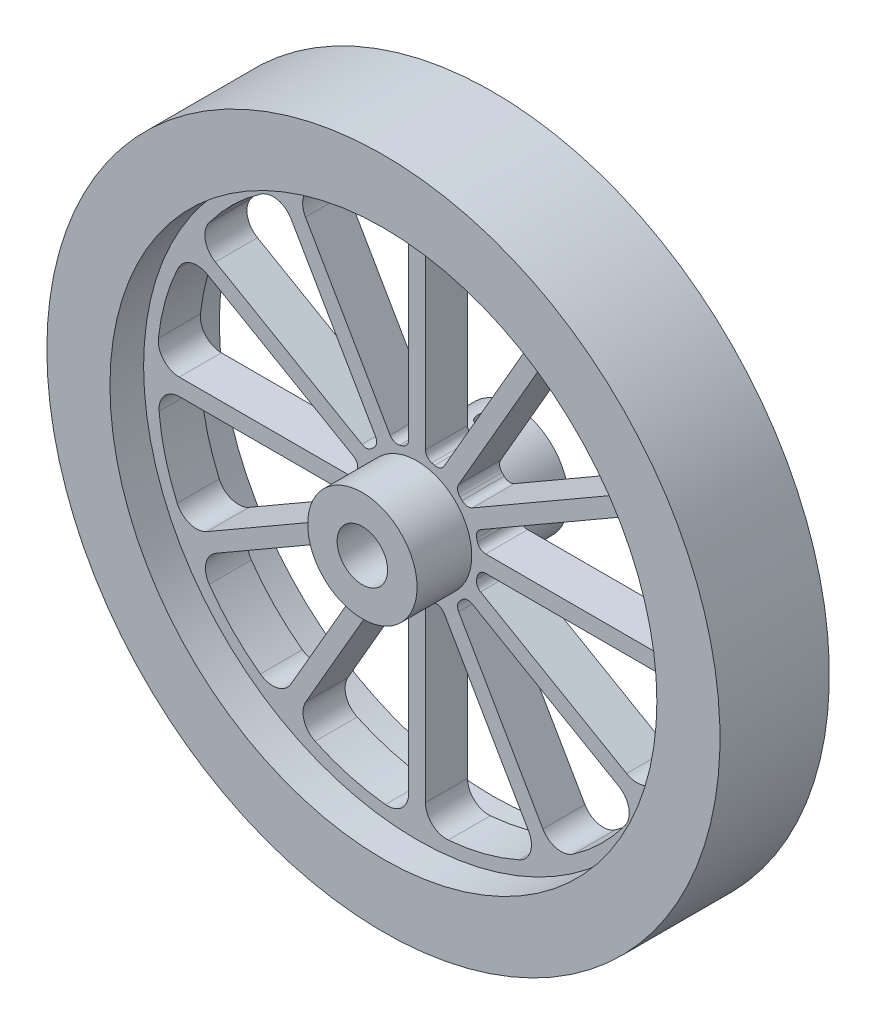
from build123d import *

# Parameters (mm, degrees)
SKETCH1_R           = 80
SKETCH1_R_2         = 65
BOSS_EXTRUDE1_DEPTH = 13
SKETCH1_4_R         = 65
SKETCH1_4_R_2       = 13
BOSS_EXTRUDE2_DEPTH = 5
SKETCH1_5_R         = 13
SKETCH1_5_R_2       = 6
BOSS_EXTRUDE3_DEPTH = 18
SKETCH3_R           = 2.5
CUT_EXTRUDE1_DEPTH  = 18


with BuildPart() as part:
    # Sketch1 → Boss-Extrude1 (new, symmetric)
    with BuildSketch(Plane.XY):
        Circle(SKETCH1_R)
        Circle(SKETCH1_R_2, mode=Mode.SUBTRACT)
    extrude(amount=BOSS_EXTRUDE1_DEPTH, both=True)

    # Sketch1<4> → Boss-Extrude2 (add, symmetric)
    with BuildSketch(Plane.XY):
        Circle(SKETCH1_4_R)
        with BuildLine():
            ThreePointArc((-10.194575037, -10.692798107), (-9.625898877, -11.845959285), (-9.876737792, -13.107011669))
            Line((-9.876737792, -13.107011669), (-29.989221362, -47.942855078))
            ThreePointArc((-29.989221362, -47.942855078), (-33.282212119, -50.334107308), (-37.262279736, -49.485027147))
            ThreePointArc((-37.262279736, -49.485027147), (-43.847720854, -43.796409306), (-49.400616804, -37.096129146))
            ThreePointArc((-49.400616804, -37.096129146), (-50.179569442, -33.149343226), (-47.799166853, -29.906262926))
            Line((-47.799166853, -29.906262926), (-13.107011669, -9.876737792))
            ThreePointArc((-13.107011669, -9.876737792), (-11.845959285, -9.625898877), (-10.692798107, -10.194575037))
            Line((-10.692798107, -10.194575037), (-10.194575037, -10.692798107))
        make_face(mode=Mode.SUBTRACT)
        with BuildLine():
            ThreePointArc((-3.48236191, -14.357522317), (-2.413293319, -15.071851111), (-2, -16.289373969))
            Line((-2, -16.289373969), (-2, -56.514341108))
            ThreePointArc((-2, -56.514341108), (-3.656187536, -60.231721665), (-7.527567281, -61.486430484))
            ThreePointArc((-7.527567281, -61.486430484), (-16.075035504, -59.85266348), (-24.234124542, -56.826498625))
            ThreePointArc((-24.234124542, -56.826498625), (-26.882110275, -53.797958073), (-26.442161311, -49.799166853))
            Line((-26.442161311, -49.799166853), (-6.412636177, -15.107011669))
            ThreePointArc((-6.412636177, -15.107011669), (-5.445952234, -14.259252604), (-4.162947279, -14.175160016))
            Line((-4.162947279, -14.175160016), (-3.48236191, -14.357522317))
        make_face(mode=Mode.SUBTRACT)
        with BuildLine():
            ThreePointArc((-14.175160016, -4.162947279), (-14.259252604, -5.445952234), (-15.107011669, -6.412636177))
            Line((-15.107011669, -6.412636177), (-49.942855078, -26.525119746))
            ThreePointArc((-49.942855078, -26.525119746), (-53.990294843, -26.949509546), (-57.012594428, -24.224150748))
            ThreePointArc((-57.012594428, -24.224150748), (-59.87144481, -16.004942627), (-61.330253688, -7.425881821))
            ThreePointArc((-61.330253688, -7.425881821), (-60.0314535, -3.618388631), (-56.348424237, -2))
            Line((-56.348424237, -2), (-16.289373969, -2))
            ThreePointArc((-16.289373969, -2), (-15.071851111, -2.413293319), (-14.357522317, -3.48236191))
            Line((-14.357522317, -3.48236191), (-14.175160016, -4.162947279))
        make_face(mode=Mode.SUBTRACT)
        Circle(SKETCH1_4_R_2, mode=Mode.SUBTRACT)
        with BuildLine():
            ThreePointArc((4.162947279, -14.175160016), (5.445952234, -14.259252604), (6.412636177, -15.107011669))
            Line((6.412636177, -15.107011669), (26.525119746, -49.942855078))
            ThreePointArc((26.525119746, -49.942855078), (26.949509546, -53.990294843), (24.224150748, -57.012594428))
            ThreePointArc((24.224150748, -57.012594428), (16.004942627, -59.87144481), (7.425881821, -61.330253688))
            ThreePointArc((7.425881821, -61.330253688), (3.618388631, -60.0314535), (2, -56.348424237))
            Line((2, -56.348424237), (2, -16.289373969))
            ThreePointArc((2, -16.289373969), (2.413293319, -15.071851111), (3.48236191, -14.357522317))
            Line((3.48236191, -14.357522317), (4.162947279, -14.175160016))
        make_face(mode=Mode.SUBTRACT)
        with BuildLine():
            ThreePointArc((10.692798107, -10.194575037), (11.845959285, -9.625898877), (13.107011669, -9.876737792))
            Line((13.107011669, -9.876737792), (47.942855078, -29.989221362))
            ThreePointArc((47.942855078, -29.989221362), (50.334107308, -33.282212119), (49.485027147, -37.262279736))
            ThreePointArc((49.485027147, -37.262279736), (43.796409306, -43.847720854), (37.096129146, -49.400616804))
            ThreePointArc((37.096129146, -49.400616804), (33.149343226, -50.179569442), (29.906262926, -47.799166853))
            Line((29.906262926, -47.799166853), (9.876737792, -13.107011669))
            ThreePointArc((9.876737792, -13.107011669), (9.625898877, -11.845959285), (10.194575037, -10.692798107))
            Line((10.194575037, -10.692798107), (10.692798107, -10.194575037))
        make_face(mode=Mode.SUBTRACT)
        with BuildLine():
            ThreePointArc((14.357522317, -3.48236191), (15.071851111, -2.413293319), (16.289373969, -2))
            Line((16.289373969, -2), (56.514341108, -2))
            ThreePointArc((56.514341108, -2), (60.231721665, -3.656187536), (61.486430484, -7.527567281))
            ThreePointArc((61.486430484, -7.527567281), (59.85266348, -16.075035504), (56.826498625, -24.234124542))
            ThreePointArc((56.826498625, -24.234124542), (53.797958073, -26.882110275), (49.799166853, -26.442161311))
            Line((49.799166853, -26.442161311), (15.107011669, -6.412636177))
            ThreePointArc((15.107011669, -6.412636177), (14.259252604, -5.445952234), (14.175160016, -4.162947279))
            Line((14.175160016, -4.162947279), (14.357522317, -3.48236191))
        make_face(mode=Mode.SUBTRACT)
        with BuildLine():
            ThreePointArc((-14.357522317, 3.48236191), (-15.071851111, 2.413293319), (-16.289373969, 2))
            Line((-16.289373969, 2), (-56.514341108, 2))
            ThreePointArc((-56.514341108, 2), (-60.231721665, 3.656187536), (-61.486430484, 7.527567281))
            ThreePointArc((-61.486430484, 7.527567281), (-59.85266348, 16.075035504), (-56.826498625, 24.234124542))
            ThreePointArc((-56.826498625, 24.234124542), (-53.797958073, 26.882110275), (-49.799166853, 26.442161311))
            Line((-49.799166853, 26.442161311), (-15.107011669, 6.412636177))
            ThreePointArc((-15.107011669, 6.412636177), (-14.259252604, 5.445952234), (-14.175160016, 4.162947279))
            Line((-14.175160016, 4.162947279), (-14.357522317, 3.48236191))
        make_face(mode=Mode.SUBTRACT)
        with BuildLine():
            ThreePointArc((-10.692798107, 10.194575037), (-11.845959285, 9.625898877), (-13.107011669, 9.876737792))
            Line((-13.107011669, 9.876737792), (-47.942855078, 29.989221362))
            ThreePointArc((-47.942855078, 29.989221362), (-50.334107308, 33.282212119), (-49.485027147, 37.262279736))
            ThreePointArc((-49.485027147, 37.262279736), (-43.796409306, 43.847720854), (-37.096129146, 49.400616804))
            ThreePointArc((-37.096129146, 49.400616804), (-33.149343226, 50.179569442), (-29.906262926, 47.799166853))
            Line((-29.906262926, 47.799166853), (-9.876737792, 13.107011669))
            ThreePointArc((-9.876737792, 13.107011669), (-9.625898877, 11.845959285), (-10.194575037, 10.692798107))
            Line((-10.194575037, 10.692798107), (-10.692798107, 10.194575037))
        make_face(mode=Mode.SUBTRACT)
        with BuildLine():
            ThreePointArc((-4.162947279, 14.175160016), (-5.445952234, 14.259252604), (-6.412636177, 15.107011669))
            Line((-6.412636177, 15.107011669), (-26.525119746, 49.942855078))
            ThreePointArc((-26.525119746, 49.942855078), (-26.949509546, 53.990294843), (-24.224150748, 57.012594428))
            ThreePointArc((-24.224150748, 57.012594428), (-16.004942627, 59.87144481), (-7.425881821, 61.330253688))
            ThreePointArc((-7.425881821, 61.330253688), (-3.618388631, 60.0314535), (-2, 56.348424237))
            Line((-2, 56.348424237), (-2, 16.289373969))
            ThreePointArc((-2, 16.289373969), (-2.413293319, 15.071851111), (-3.48236191, 14.357522317))
            Line((-3.48236191, 14.357522317), (-4.162947279, 14.175160016))
        make_face(mode=Mode.SUBTRACT)
        with BuildLine():
            ThreePointArc((14.175160016, 4.162947279), (14.259252604, 5.445952234), (15.107011669, 6.412636177))
            Line((15.107011669, 6.412636177), (49.942855078, 26.525119746))
            ThreePointArc((49.942855078, 26.525119746), (53.990294843, 26.949509546), (57.012594428, 24.224150748))
            ThreePointArc((57.012594428, 24.224150748), (59.87144481, 16.004942627), (61.330253688, 7.425881821))
            ThreePointArc((61.330253688, 7.425881821), (60.0314535, 3.618388631), (56.348424237, 2))
            Line((56.348424237, 2), (16.289373969, 2))
            ThreePointArc((16.289373969, 2), (15.071851111, 2.413293319), (14.357522317, 3.48236191))
            Line((14.357522317, 3.48236191), (14.175160016, 4.162947279))
        make_face(mode=Mode.SUBTRACT)
        with BuildLine():
            ThreePointArc((3.48236191, 14.357522317), (2.413293319, 15.071851111), (2, 16.289373969))
            Line((2, 16.289373969), (2, 56.514341108))
            ThreePointArc((2, 56.514341108), (3.656187536, 60.231721665), (7.527567281, 61.486430484))
            ThreePointArc((7.527567281, 61.486430484), (16.075035504, 59.85266348), (24.234124542, 56.826498625))
            ThreePointArc((24.234124542, 56.826498625), (26.882110275, 53.797958073), (26.442161311, 49.799166853))
            Line((26.442161311, 49.799166853), (6.412636177, 15.107011669))
            ThreePointArc((6.412636177, 15.107011669), (5.445952234, 14.259252604), (4.162947279, 14.175160016))
            Line((4.162947279, 14.175160016), (3.48236191, 14.357522317))
        make_face(mode=Mode.SUBTRACT)
        with BuildLine():
            ThreePointArc((10.194575037, 10.692798107), (9.625898877, 11.845959285), (9.876737792, 13.107011669))
            Line((9.876737792, 13.107011669), (29.989221362, 47.942855078))
            ThreePointArc((29.989221362, 47.942855078), (33.282212119, 50.334107308), (37.262279736, 49.485027147))
            ThreePointArc((37.262279736, 49.485027147), (43.847720854, 43.796409306), (49.400616804, 37.096129146))
            ThreePointArc((49.400616804, 37.096129146), (50.179569442, 33.149343226), (47.799166853, 29.906262926))
            Line((47.799166853, 29.906262926), (13.107011669, 9.876737792))
            ThreePointArc((13.107011669, 9.876737792), (11.845959285, 9.625898877), (10.692798107, 10.194575037))
            Line((10.692798107, 10.194575037), (10.194575037, 10.692798107))
        make_face(mode=Mode.SUBTRACT)
    extrude(amount=BOSS_EXTRUDE2_DEPTH, both=True)

    # Sketch1<5> → Boss-Extrude3 (add, symmetric)
    with BuildSketch(Plane.XY):
        Circle(SKETCH1_5_R)
        Circle(SKETCH1_5_R_2, mode=Mode.SUBTRACT)
    extrude(amount=BOSS_EXTRUDE3_DEPTH, both=True)

    # Sketch3 → Cut-Extrude1 (cut, symmetric)
    with BuildSketch(Plane(origin=(0, 0, 0), x_dir=(1, 0, 0), z_dir=(0, 1, 0))):
        with Locations((0, 12)):
            Circle(SKETCH3_R)
    extrude(amount=CUT_EXTRUDE1_DEPTH, both=True, mode=Mode.SUBTRACT)


solid = part.part
